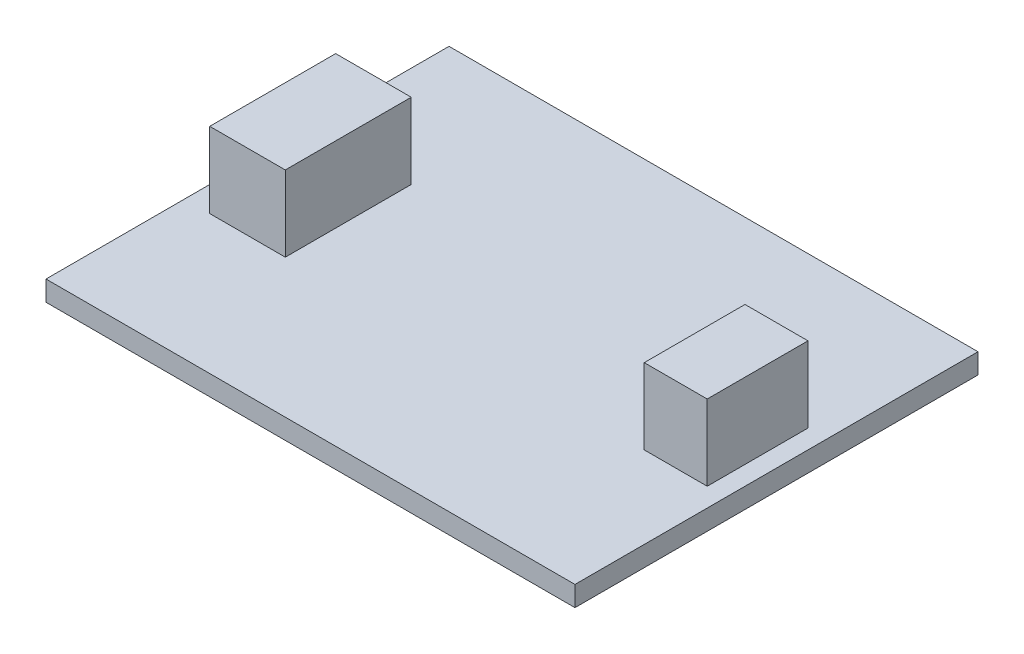
from build123d import *

# Parameters (mm, degrees)
SKETCH1_W             = 42
SKETCH1_H             = 32
BOARD_DEPTH           = 1.6
PROBE_CONNECTOR_START = 1.6
SKETCH2_W             = 6
SKETCH2_H             = 10
PROBE_CONNECTOR_DEPTH = 6
SIGNAL_HEADER_START   = 1.6
SKETCH3_W             = 5
SKETCH3_H             = 8
SIGNAL_HEADER_DEPTH   = 6


with BuildPart() as part:
    # Sketch1 → Board (new body)
    with BuildSketch(Plane(origin=(0, 0, 0), x_dir=(1, 0, 0), z_dir=(0, 1, 0))):
        Rectangle(SKETCH1_W, SKETCH1_H)
    extrude(amount=BOARD_DEPTH)

    # Sketch2 → Probe_Connector (add)
    with BuildSketch(Plane(origin=(0, 0, 0), x_dir=(1, 0, 0), z_dir=(0, 1, 0)).offset(PROBE_CONNECTOR_START)):
        with Locations((-16, 0)):
            Rectangle(SKETCH2_W, SKETCH2_H)
    extrude(amount=PROBE_CONNECTOR_DEPTH)

    # Sketch3 → Signal_Header (add)
    with BuildSketch(Plane(origin=(0, 0, 0), x_dir=(1, 0, 0), z_dir=(0, 1, 0)).offset(SIGNAL_HEADER_START)):
        with Locations((17, 0)):
            Rectangle(SKETCH3_W, SKETCH3_H)
    extrude(amount=SIGNAL_HEADER_DEPTH)


solid = part.part
